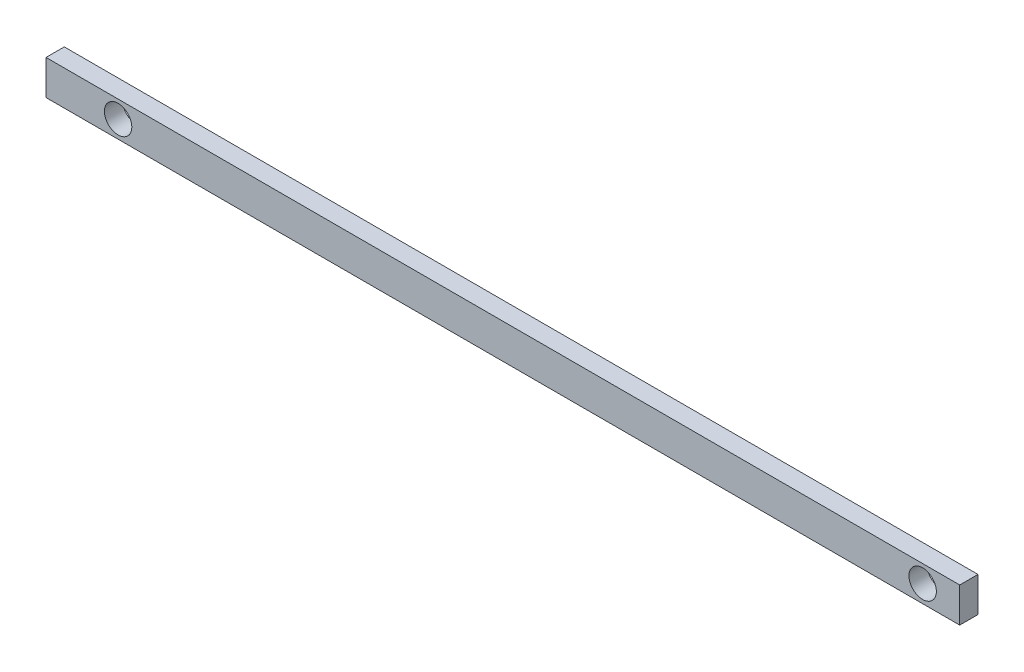
from build123d import *

# Parameters (mm, degrees)
SKETCH1_W           = 500
SKETCH1_H           = 19.035532994
SKETCH1_R           = 7.5
BOSS_EXTRUDE1_DEPTH = 10


with BuildPart() as part:
    # Sketch1 → Boss-Extrude1 (new body)
    with BuildSketch(Plane.XY):
        Rectangle(SKETCH1_W, SKETCH1_H)
        with Locations((-210.549507461, 0)):
            Circle(SKETCH1_R, mode=Mode.SUBTRACT)
        with Locations((229.708492539, 0)):
            Circle(SKETCH1_R, mode=Mode.SUBTRACT)
    extrude(amount=BOSS_EXTRUDE1_DEPTH)


solid = part.part
